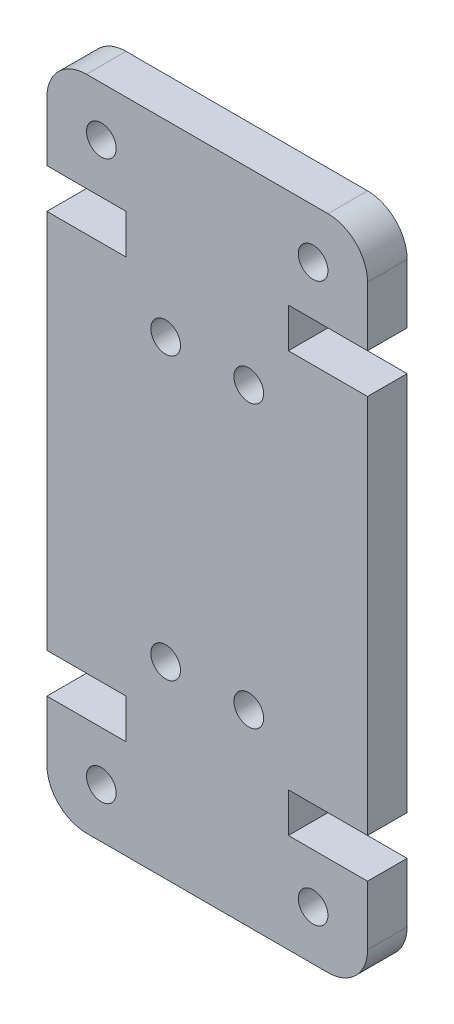
from build123d import *

# Parameters (mm, degrees)
SKETCH1_R           = 0.75
BOSS_EXTRUDE1_DEPTH = 4
SKETCH2_W           = 16.2
SKETCH2_H           = 33.21
CUT_EXTRUDE2_DEPTH  = 2


with BuildPart() as part:
    # Sketch1 → Boss-Extrude1 (new body)
    with BuildSketch(Plane.XY):
        with BuildLine():
            Line((0, 26.21), (0, 7))
            Line((0, 7), (4, 7))
            Line((4, 7), (4, 5))
            Line((4, 5), (0, 5))
            Line((0, 5), (0, 2))
            ThreePointArc((0, 2), (0.585786438, 0.585786438), (2, 0))
            Line((2, 0), (14.2, 0))
            ThreePointArc((14.2, 0), (15.614213562, 0.585786438), (16.2, 2))
            Line((16.2, 2), (16.2, 5))
            Line((16.2, 5), (12.2, 5))
            Line((12.2, 5), (12.2, 7))
            Line((12.2, 7), (16.2, 7))
            Line((16.2, 7), (16.2, 26.21))
            Line((16.2, 26.21), (12.2, 26.21))
            Line((12.2, 26.21), (12.2, 28.21))
            Line((12.2, 28.21), (16.2, 28.21))
            Line((16.2, 28.21), (16.2, 31.21))
            ThreePointArc((16.2, 31.21), (15.614213562, 32.624213562), (14.2, 33.21))
            Line((14.2, 33.21), (2, 33.21))
            ThreePointArc((2, 33.21), (0.585786438, 32.624213562), (0, 31.21))
            Line((0, 31.21), (0, 28.21))
            Line((0, 28.21), (4, 28.21))
            Line((4, 28.21), (4, 26.21))
            Line((4, 26.21), (0, 26.21))
        make_face()
        with Locations((13.45, 2.5)):
            Circle(SKETCH1_R, mode=Mode.SUBTRACT)
        with Locations((10.2, 9.5)):
            Circle(SKETCH1_R, mode=Mode.SUBTRACT)
        with Locations((2.75, 30.71)):
            Circle(SKETCH1_R, mode=Mode.SUBTRACT)
        with Locations((6, 23.71)):
            Circle(SKETCH1_R, mode=Mode.SUBTRACT)
        with Locations((6, 9.5)):
            Circle(SKETCH1_R, mode=Mode.SUBTRACT)
        with Locations((2.75, 2.5)):
            Circle(SKETCH1_R, mode=Mode.SUBTRACT)
        with Locations((10.2, 23.71)):
            Circle(SKETCH1_R, mode=Mode.SUBTRACT)
        with Locations((13.45, 30.71)):
            Circle(SKETCH1_R, mode=Mode.SUBTRACT)
    extrude(amount=BOSS_EXTRUDE1_DEPTH)

    # Sketch2 → Cut-Extrude2 (cut)
    with BuildSketch(Plane.XY):
        with Locations((8.1, 16.605)):
            Rectangle(SKETCH2_W, SKETCH2_H)
    extrude(amount=CUT_EXTRUDE2_DEPTH, mode=Mode.SUBTRACT)


solid = part.part
